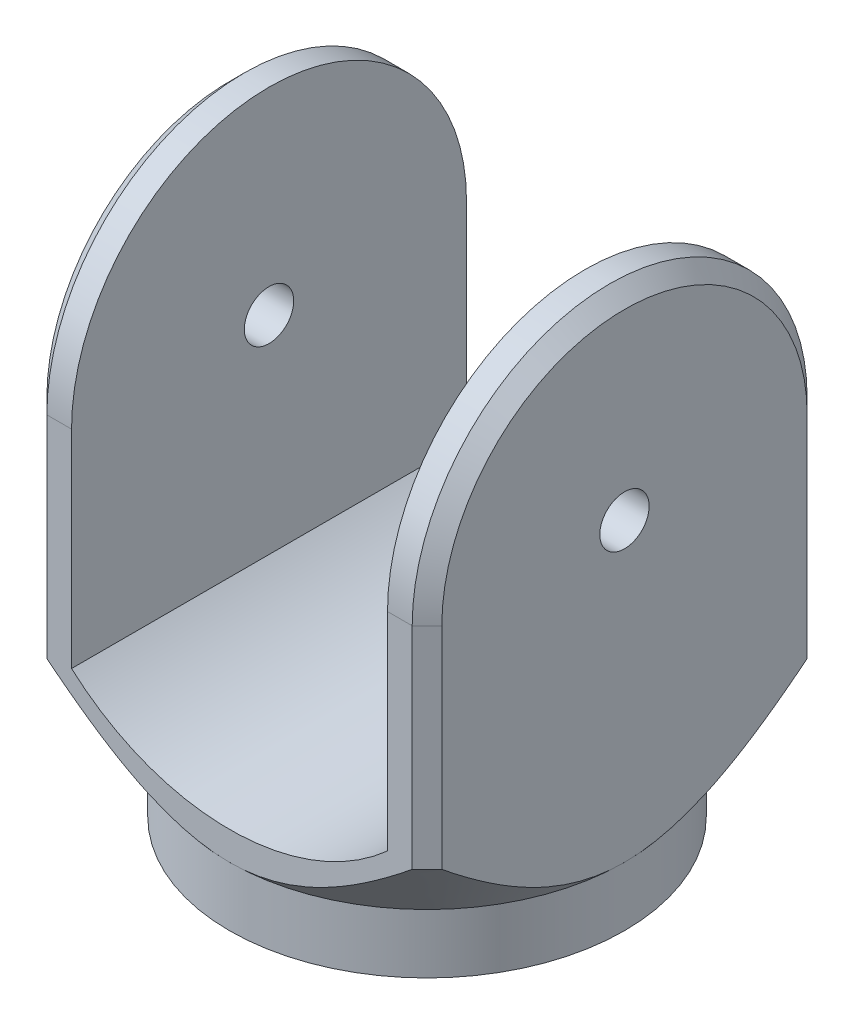
from build123d import *

# Parameters (mm, degrees)
SKETCH1_R               = 12.5
BOSS_EXTRUDE1_DEPTH     = 100
CUT_EXTRUDE1_DEPTH      = 80
CHAMFER2_SIZE           = 7.5
CUT_EXTRUDE2_DEPTH      = 288.054001888
CUT_EXTRUDE2_DEPTH_BACK = 288.054001888


with BuildPart() as part:
    # Sketch1 → Boss-Extrude1 (new, symmetric)
    with BuildSketch(Plane(origin=(0, 0, 0), x_dir=(0, 0, -1), z_dir=(1, 0, 0))):
        with BuildLine():
            Line((-100, 0), (-100, -180))
            Line((-100, -180), (100, -180))
            Line((100, -180), (100, 0))
            ThreePointArc((100, 0), (0, 100), (-100, 0))
        make_face()
        Circle(SKETCH1_R, mode=Mode.SUBTRACT)
    extrude(amount=BOSS_EXTRUDE1_DEPTH, both=True)

    # Sketch2 → Cut-Revolve1 (revolve, cut)
    with BuildSketch(Plane(origin=(0, 0, 0), x_dir=(0, 0, -1), z_dir=(1, 0, 0)), mode=Mode.PRIVATE) as cut_revolve1_sk:
        Polygon((100, -180), (100, -150), (150, -90.41232037), (150, -180), align=None)
    revolve(cut_revolve1_sk.sketch.rotate(Axis((0, 100, 0), (0, -1, 0)), 180), axis=Axis((0, 100, 0), (0, -1, 0)), mode=Mode.SUBTRACT)

    # Sketch3 → Cut-Extrude1 (cut, symmetric)
    with BuildSketch(Plane(origin=(0, 0, 0), x_dir=(0, 0, -1), z_dir=(1, 0, 0))):
        with BuildLine():
            Line((-100, 0), (-100, -105))
            Line((-100, -105), (100, -105))
            Line((100, -105), (100, 0))
            ThreePointArc((100, 0), (0, 100), (-100, 0))
        make_face()
    extrude(amount=CUT_EXTRUDE1_DEPTH, both=True, mode=Mode.SUBTRACT)

    # Chamfer2
    chamfer2_edges = [part.edges().sort_by_distance(p)[0] for p in [
        (100, -50.317974947, -100),
        (100, -50.317974947, 100),
        (100, 100, 0),
        (-100, -50.317974947, -100),
        (-100, -50.317974947, 100),
        (-100, 100, 0),
    ]]
    chamfer(chamfer2_edges, length=CHAMFER2_SIZE)

    # Sketch4 → Cut-Extrude2 (cut, two sides: drawn at the far end of the back side and taken through both)
    with BuildSketch(Plane.XY.offset(100).offset(-CUT_EXTRUDE2_DEPTH_BACK)):
        with BuildLine():
            Line((-80, -105), (80, -105))
            ThreePointArc((80, -105), (0, -135.5572809), (-80, -105))
        make_face()
    extrude(amount=CUT_EXTRUDE2_DEPTH + CUT_EXTRUDE2_DEPTH_BACK, mode=Mode.SUBTRACT)


solid = part.part
